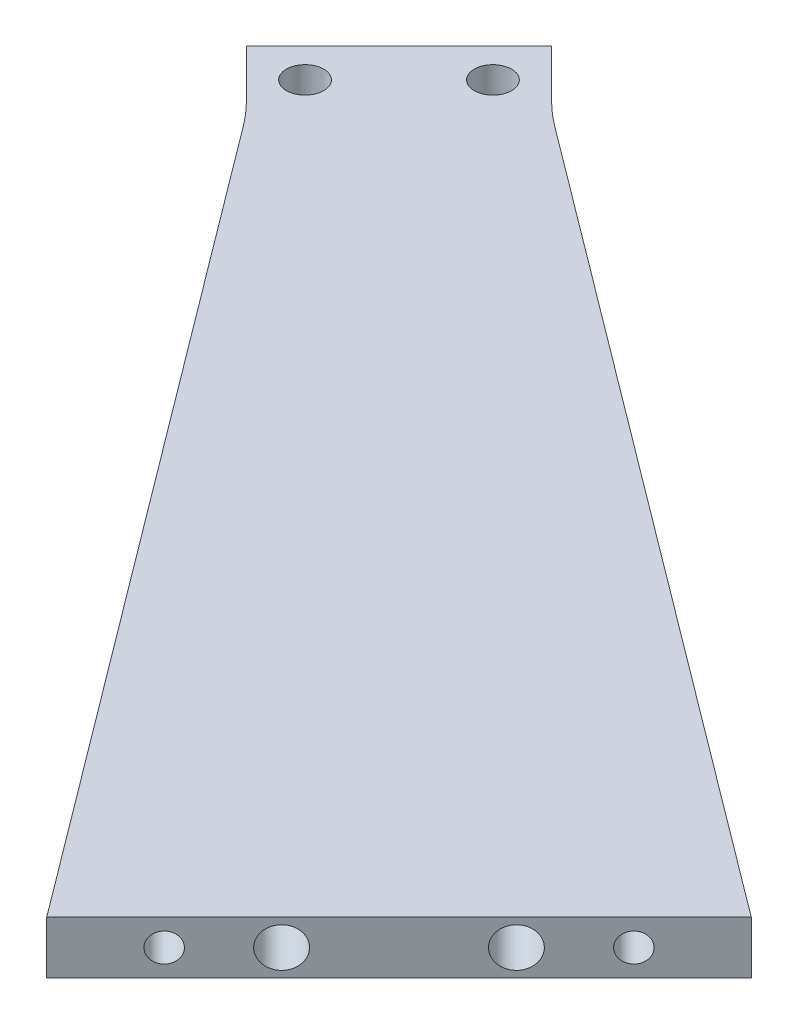
from build123d import *

# Parameters (mm, degrees)
SKETCH1_R                       = 2.25
BOSS_EXTRUDE1_DEPTH             = 3.175
F_8_32_TAPPED_HOLE1_D           = 3.4544
F_8_32_TAPPED_HOLE1_DEPTH       = 10.71
F_8_32_TAPPED_HOLE1_TIP         = 1.037806461
F_3_16_0_1875_DOWEL_HOLE1_D     = 4.7625
F_3_16_0_1875_DOWEL_HOLE1_DEPTH = 12.83
F_3_16_0_1875_DOWEL_HOLE1_TIP   = 1.430799349
FILLET1_R                       = 25


with BuildPart() as part:
    # Sketch1 → Boss-Extrude1 (new, symmetric)
    with BuildSketch(Plane(origin=(0, 0, 0), x_dir=(1, 0, 0), z_dir=(0, 1, 0))):
        Polygon((80.256619665, -122.683026536), (8.485281374, -26.870057685), (1.414213562, -19.798989873), (19.798989873, -1.414213562), (26.870057685, -8.485281374), (122.683026536, -80.256619665), align=None)
        with Locations(Location((8.485281374, -19.798989873, 0), (0, 0, 270))):
            Circle(SKETCH1_R, mode=Mode.SUBTRACT)
        with Locations(Location((19.798989873, -8.485281374, 0), (0, 0, 270))):
            Circle(SKETCH1_R, mode=Mode.SUBTRACT)
    extrude(amount=BOSS_EXTRUDE1_DEPTH, both=True)

    # #8-32 Tapped Hole1
    with Locations(Plane(origin=(101.4698231, 0, 101.4698231), x_dir=(0.7071067811865462, 0, -0.7071067811865489), z_dir=(0.7071067811865489, 0, 0.7071067811865462))):
        with Locations((20, 0), (-20, 0)):
            Hole(F_8_32_TAPPED_HOLE1_D / 2, depth=F_8_32_TAPPED_HOLE1_DEPTH)
            with Locations((0, 0, -(F_8_32_TAPPED_HOLE1_DEPTH + F_8_32_TAPPED_HOLE1_TIP / 2))):  # 118° drill point
                Cone(0, F_8_32_TAPPED_HOLE1_D / 2, F_8_32_TAPPED_HOLE1_TIP, mode=Mode.SUBTRACT)

    # 3/16 (0.1875) Dowel Hole1
    with Locations(Plane(origin=(101.4698231, 0, 101.4698231), x_dir=(0.7071067811865462, 0, -0.7071067811865489), z_dir=(0.7071067811865489, 0, 0.7071067811865462))):
        with Locations((-10, 0), (10, 0)):
            Hole(F_3_16_0_1875_DOWEL_HOLE1_D / 2, depth=F_3_16_0_1875_DOWEL_HOLE1_DEPTH)
            with Locations((0, 0, -(F_3_16_0_1875_DOWEL_HOLE1_DEPTH + F_3_16_0_1875_DOWEL_HOLE1_TIP / 2))):  # 118° drill point
                Cone(0, F_3_16_0_1875_DOWEL_HOLE1_D / 2, F_3_16_0_1875_DOWEL_HOLE1_TIP, mode=Mode.SUBTRACT)

    # Fillet1
    fillet1_edges = [part.edges().sort_by_distance(p)[0] for p in [
        (8.485281374, 0, 26.870057685),
        (26.870057685, 0, 8.485281374),
    ]]
    fillet(fillet1_edges, radius=FILLET1_R)


solid = part.part
